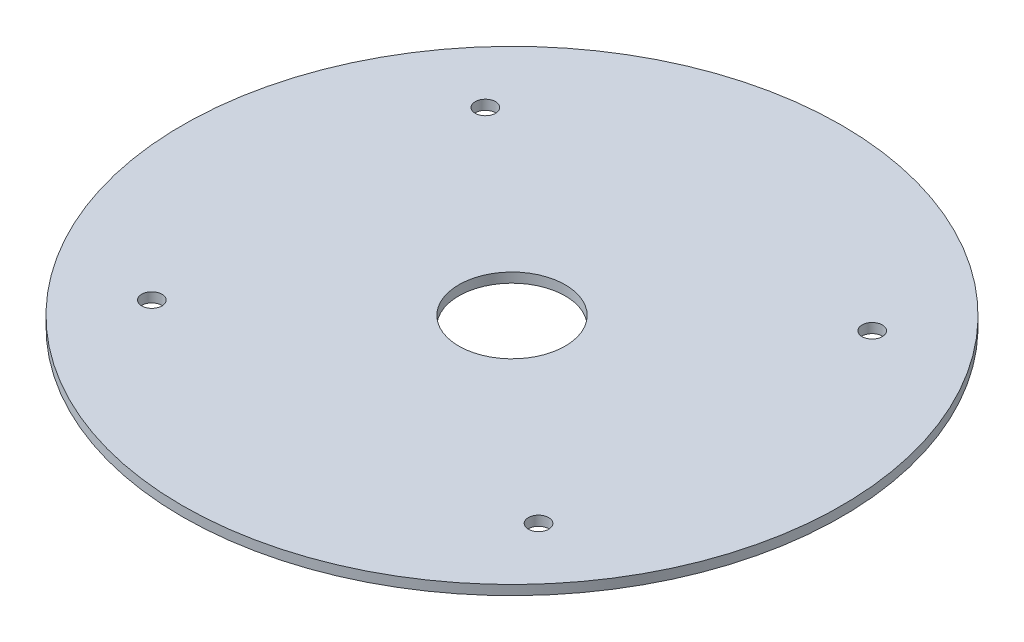
from build123d import *

# Parameters (mm, degrees)
SKETCH1_R           = 68.169021696
SKETCH1_R_2         = 2.1
SKETCH1_R_3         = 11
BOSS_EXTRUDE1_DEPTH = 2


with BuildPart() as part:
    # Sketch1 → Boss-Extrude1 (new body)
    with BuildSketch(Plane(origin=(0, 0, 0), x_dir=(1, 0, 0), z_dir=(0, 1, 0))):
        with Locations(Location((6.791388554, 8.065201027, 0), (0, 0, 270))):
            Circle(SKETCH1_R)
        with Locations(Location((-33.208844607, 42.565201027, 0), (0, 0, 270))):
            Circle(SKETCH1_R_2, mode=Mode.SUBTRACT)
        with Locations(Location((46.791621715, 42.565201027, 0), (0, 0, 270))):
            Circle(SKETCH1_R_2, mode=Mode.SUBTRACT)
        with Locations(Location((-33.208844607, -26.434798973, 0), (0, 0, 270))):
            Circle(SKETCH1_R_2, mode=Mode.SUBTRACT)
        with Locations(Location((46.796001818, -26.45083277, 0), (0, 0, 270))):
            Circle(SKETCH1_R_2, mode=Mode.SUBTRACT)
        with Locations(Location((6.791388554, 8.065201027, 0), (0, 0, 270))):
            Circle(SKETCH1_R_3, mode=Mode.SUBTRACT)
    extrude(amount=BOSS_EXTRUDE1_DEPTH)


solid = part.part
